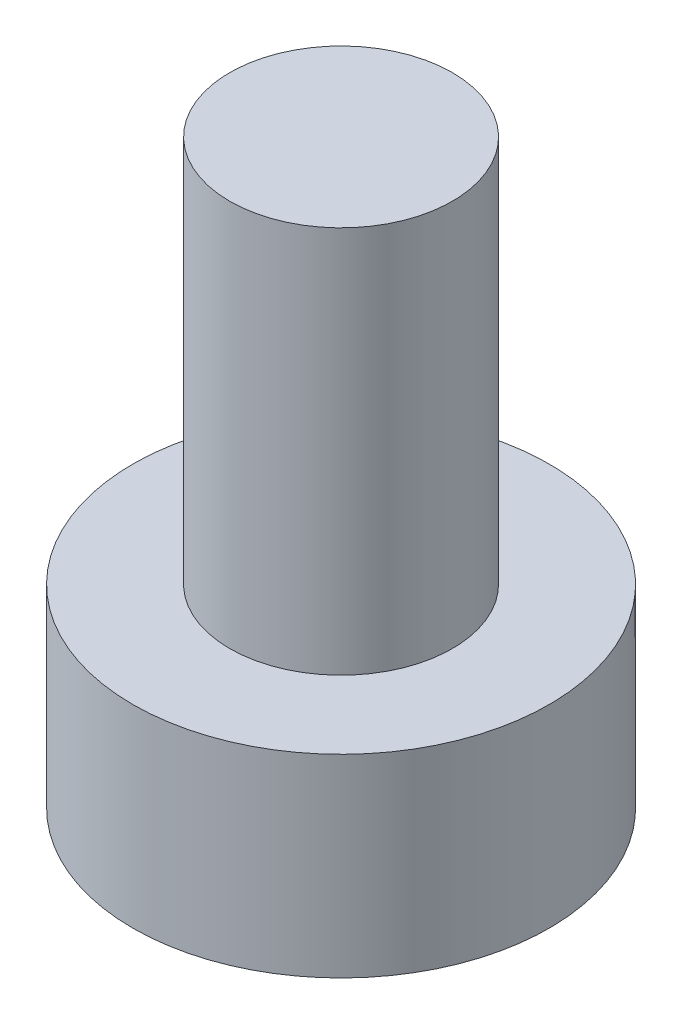
from build123d import *

# Parameters (mm, degrees)
SKETCH1_R           = 2.15
BOSS_EXTRUDE1_DEPTH = 2
SKETCH2_R           = 1.15
BOSS_EXTRUDE2_DEPTH = 4


with BuildPart() as part:
    # Sketch1 → Boss-Extrude1 (new body)
    with BuildSketch(Plane(origin=(0, 0, 0), x_dir=(1, 0, 0), z_dir=(0, 1, 0))):
        with Locations(Location((0, 0, 0), (0, 0, 270))):
            Circle(SKETCH1_R)
    extrude(amount=BOSS_EXTRUDE1_DEPTH)

    # Sketch2 → Boss-Extrude2 (add)
    with BuildSketch(Plane(origin=(0, 2, 0), x_dir=(1, 0, 0), z_dir=(0, 1, 0))):
        with Locations(Location((0, 0, 0), (0, 0, 270))):
            Circle(SKETCH2_R)
    extrude(amount=BOSS_EXTRUDE2_DEPTH)


solid = part.part
